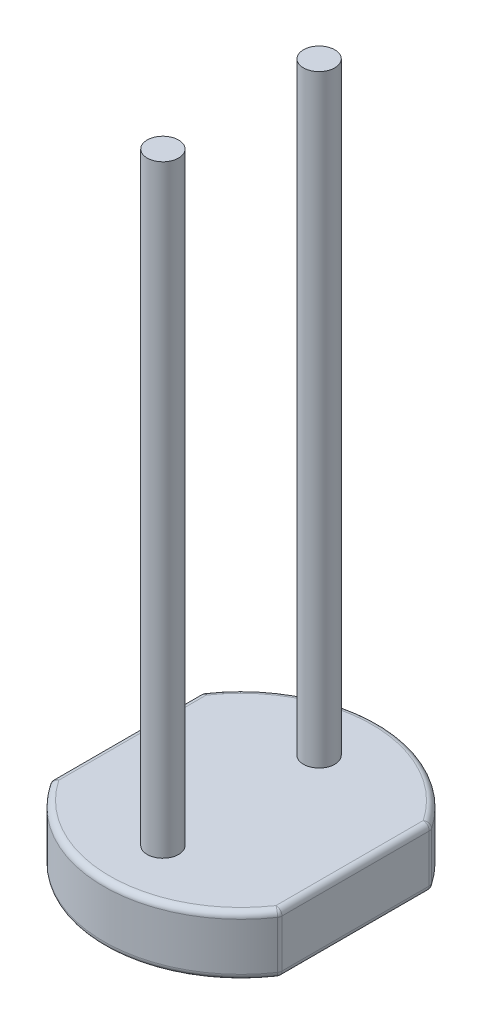
from build123d import *

# Parameters (mm, degrees)
BOSS_EXTRUDE1_DEPTH      = 1
BOSS_EXTRUDE2_DEPTH      = 10
BOSS_EXTRUDE2_DEPTH_BACK = 1.1
SKETCH2_R                = 0.26
CUT_EXTRUDE1_DEPTH       = 0.01
FILLET1_R                = 0.1


with BuildPart() as part:
    # Sketch1 → Boss-Extrude1 (new body)
    with BuildSketch(Plane(origin=(0, 0, 0), x_dir=(1, 0, 0), z_dir=(0, 1, 0))):
        with BuildLine():
            Line((-1.9, 1.251249376), (-1.9, -1.251249376))
            ThreePointArc((-1.9, -1.251249376), (0, -2.275), (1.9, -1.251249376))
            Line((1.9, -1.251249376), (1.9, 1.251249376))
            ThreePointArc((1.9, 1.251249376), (0, 2.275), (-1.9, 1.251249376))
        make_face()
    extrude(amount=BOSS_EXTRUDE1_DEPTH)

    # Sketch2 → Boss-Extrude2 (add, two sides: drawn at the far end of the back side and taken through both)
    with BuildSketch(Plane(origin=(0, 1, 0), x_dir=(1, 0, 0), z_dir=(0, 1, 0)).offset(-BOSS_EXTRUDE2_DEPTH_BACK)):
        with Locations(Location((0, 1.295, 0), (0, 0, 270))):
            Circle(SKETCH2_R)
        with Locations(Location((0, -1.295, 0), (0, 0, 270))):
            Circle(SKETCH2_R)
    extrude(amount=BOSS_EXTRUDE2_DEPTH + BOSS_EXTRUDE2_DEPTH_BACK)

    # Sketch4 → Cut-Extrude1 (cut)
    with BuildSketch(Plane.XZ):
        with BuildLine():
            Line((1.9, -1.251249376), (1.9, 1.251249376))
            ThreePointArc((1.9, 1.251249376), (0, 2.275), (-1.9, 1.251249376))
            Line((-1.9, 1.251249376), (-1.9, -1.251249376))
            ThreePointArc((-1.9, -1.251249376), (0, -2.275), (1.9, -1.251249376))
        make_face()
        with BuildLine():
            Line((-1.4, 1.091157642), (-1.4, -1.091157642))
            ThreePointArc((-1.4, -1.091157642), (0, -1.775), (1.4, -1.091157642))
            Line((1.4, -1.091157642), (1.4, 1.091157642))
            ThreePointArc((1.4, 1.091157642), (1.375341403, 1.122078885), (1.35, 1.152443057))
            Line((1.35, 1.152443057), (1.35, -1))
            ThreePointArc((1.35, -1), (1.2, -1.15), (1.05, -1))
            Line((1.05, -1), (1.05, 0.9))
            ThreePointArc((1.05, 0.9), (0.9, 1.05), (0.75, 0.9))
            Line((0.75, 0.9), (0.75, -0.9))
            ThreePointArc((0.75, -0.9), (0.6, -1.05), (0.45, -0.9))
            Line((0.45, -0.9), (0.45, 0.7))
            ThreePointArc((0.45, 0.7), (0.3, 0.85), (0.15, 0.7))
            Line((0.15, 0.7), (0.15, -0.75))
            ThreePointArc((0.15, -0.75), (0, -0.9), (-0.15, -0.75))
            Line((-0.15, -0.75), (-0.15, 0.7))
            ThreePointArc((-0.15, 0.7), (-0.3, 0.85), (-0.45, 0.7))
            Line((-0.45, 0.7), (-0.45, -0.9))
            ThreePointArc((-0.45, -0.9), (-0.6, -1.05), (-0.75, -0.9))
            Line((-0.75, -0.9), (-0.75, 0.9))
            ThreePointArc((-0.75, 0.9), (-0.9, 1.05), (-1.05, 0.9))
            Line((-1.05, 0.9), (-1.05, -1))
            ThreePointArc((-1.05, -1), (-1.2, -1.15), (-1.35, -1))
            Line((-1.35, -1), (-1.35, 1.152443057))
            ThreePointArc((-1.35, 1.152443057), (-1.375341403, 1.122078885), (-1.4, 1.091157642))
        make_face(mode=Mode.SUBTRACT)
        with BuildLine():
            Line((1.25, 1.152443057), (1.25, -1))
            ThreePointArc((1.25, -1), (1.2, -1.05), (1.15, -1))
            Line((1.15, -1), (1.15, 0.9))
            ThreePointArc((1.15, 0.9), (0.9, 1.15), (0.65, 0.9))
            Line((0.65, 0.9), (0.65, -0.9))
            ThreePointArc((0.65, -0.9), (0.6, -0.95), (0.55, -0.9))
            Line((0.55, -0.9), (0.55, 0.7))
            ThreePointArc((0.55, 0.7), (0.3, 0.95), (0.05, 0.7))
            Line((0.05, 0.7), (0.05, -0.75))
            ThreePointArc((0.05, -0.75), (0.035355339, -0.785355339), (0, -0.8))
            ThreePointArc((0, -0.8), (-0.035355339, -0.785355339), (-0.05, -0.75))
            Line((-0.05, -0.75), (-0.05, 0.7))
            ThreePointArc((-0.05, 0.7), (-0.3, 0.95), (-0.55, 0.7))
            Line((-0.55, 0.7), (-0.55, -0.9))
            ThreePointArc((-0.55, -0.9), (-0.6, -0.95), (-0.65, -0.9))
            Line((-0.65, -0.9), (-0.65, 0.9))
            ThreePointArc((-0.65, 0.9), (-0.9, 1.15), (-1.15, 0.9))
            Line((-1.15, 0.9), (-1.15, -1))
            ThreePointArc((-1.15, -1), (-1.2, -1.05), (-1.25, -1))
            Line((-1.25, -1), (-1.25, 1.152443057))
            Line((-1.25, 1.152443057), (-1.25, 1.260208316))
            ThreePointArc((-1.25, 1.260208316), (0, 1.775), (1.25, 1.260208316))
            Line((1.25, 1.260208316), (1.25, 1.152443057))
        make_face(mode=Mode.SUBTRACT)
    extrude(amount=-CUT_EXTRUDE1_DEPTH, mode=Mode.SUBTRACT)

    # Fillet1
    fillet1_edges = [part.edges().sort_by_distance(p)[0] for p in [
        (0, 1, 2.275),
        (1.9, 1, 0),
        (0, 1, -2.275),
        (0, 0.01, -2.275),
        (-1.9, 0.01, 0),
        (0, 0.01, 2.275),
        (1.9, 0.01, 0),
        (-1.9, 1, 0),
        (1.9, 0.505, -1.251249376),
        (1.9, 0.505, 1.251249376),
        (-1.9, 0.505, 1.251249376),
        (-1.9, 0.505, -1.251249376),
    ]]
    fillet(fillet1_edges, radius=FILLET1_R)


solid = part.part
